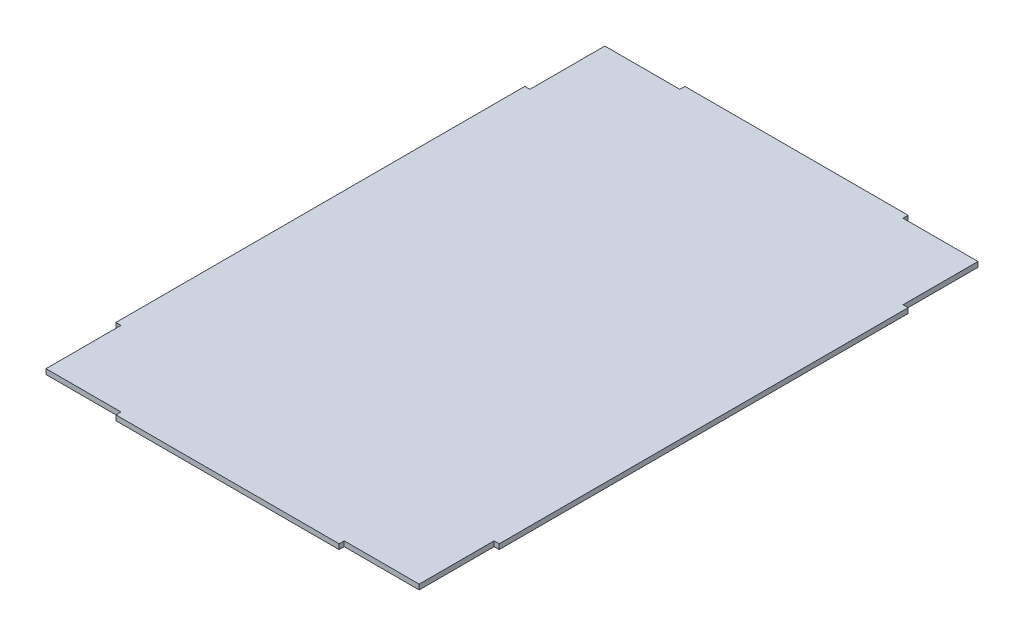
from build123d import *

# Parameters (mm, degrees)
SKETCH1_W           = 479
SKETCH1_H           = 711
BOSS_EXTRUDE1_DEPTH = 3.175
CUT_EXTRUDE1_DEPTH  = 429.696655574


with BuildPart() as part:
    # Sketch1 → Boss-Extrude1 (new, symmetric)
    with BuildSketch(Plane(origin=(0, 0, 0), x_dir=(1, 0, 0), z_dir=(0, 1, 0))):
        Rectangle(SKETCH1_W, SKETCH1_H)
    extrude(amount=BOSS_EXTRUDE1_DEPTH, both=True)

    # Sketch2 → Cut-Extrude1 (cut, through all)
    with BuildSketch(Plane(origin=(0, 3.175, 0), x_dir=(1, 0, 0), z_dir=(0, 1, 0))):
        Polygon((-239.5, 355.5), (-239.5, 255.5), (-233.15, 255.5), (-233.15, 349.15), (-139.5, 349.15), (-139.5, 355.5), align=None)
        Polygon((239.5, 355.5), (139.5, 355.5), (139.5, 349.15), (233.15, 349.15), (233.15, 255.5), (239.5, 255.5), align=None)
        Polygon((239.5, -355.5), (239.5, -255.5), (233.15, -255.5), (233.15, -349.15), (139.5, -349.15), (139.5, -355.5), align=None)
        Polygon((-239.5, -355.5), (-139.5, -355.5), (-139.5, -349.15), (-233.15, -349.15), (-233.15, -255.5), (-239.5, -255.5), align=None)
    extrude(amount=-CUT_EXTRUDE1_DEPTH, mode=Mode.SUBTRACT)


solid = part.part
